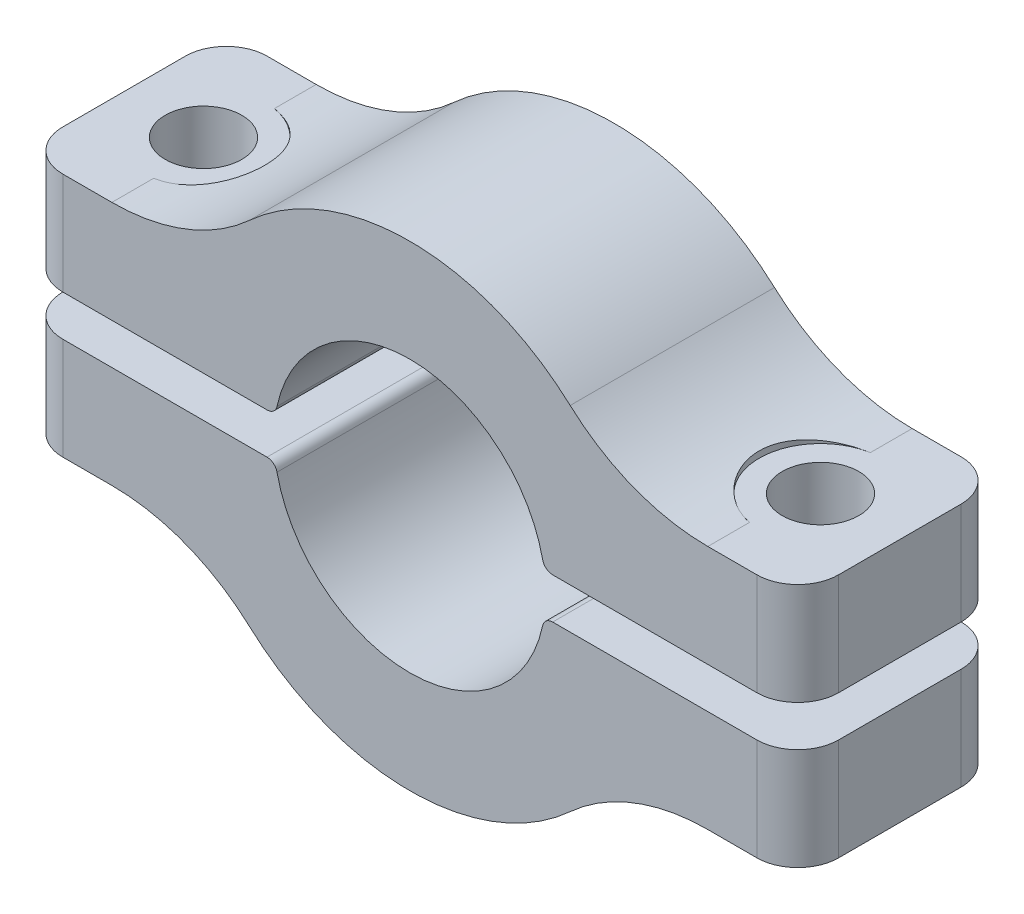
from build123d import *

# Parameters (mm, degrees)
BOSS_EXTRUDE1_DEPTH = 10
FILLET1_R           = 2
FILLET3_R           = 0.5
FILLET4_R           = 10
SKETCH2_R           = 1.875
CUT_EXTRUDE1_DEPTH  = 25.417106227
CUT_EXTRUDE2_START  = 6
SKETCH3_R           = 3
CUT_EXTRUDE2_DEPTH  = 10


with BuildPart() as part:
    # Sketch1 → Boss-Extrude1 (new body)
    with BuildSketch(Plane.XY):
        with BuildLine():
            Line((-18.986115361, 1), (-6.5743821, 1))
            ThreePointArc((-6.5743821, 1), (0, 6.65), (6.5743821, 1))
            Line((6.5743821, 1), (18.986115361, 1))
            Line((18.986115361, 1), (18.986115361, 6))
            Line((18.986115361, 6), (9.986115361, 6))
            ThreePointArc((9.986115361, 6), (0, 11.65), (-9.986115361, 6))
            Line((-9.986115361, 6), (-18.986115361, 6))
            Line((-18.986115361, 6), (-18.986115361, 1))
        make_face()
    extrude(amount=BOSS_EXTRUDE1_DEPTH)

    # Fillet1
    fillet1_edges = [part.edges().sort_by_distance(p)[0] for p in [
        (-18.986115361, 3.5, 0),
        (18.986115361, 3.5, 10),
        (-18.986115361, 3.5, 10),
        (18.986115361, 3.5, 0),
    ]]
    fillet(fillet1_edges, radius=FILLET1_R)

    # Fillet3
    fillet3_edges = [part.edges().sort_by_distance(p)[0] for p in [
        (6.5743821, 1, 5),
        (-6.5743821, 1, 5),
    ]]
    fillet(fillet3_edges, radius=FILLET3_R)

    # Fillet4
    fillet4_edges = [part.edges().sort_by_distance(p)[0] for p in [
        (-9.986115361, 6, 5),
        (9.986115361, 6, 5),
    ]]
    fillet(fillet4_edges, radius=FILLET4_R)

    # Sketch2 → Cut-Extrude1 (cut, through all)
    with BuildSketch(Plane(origin=(0, 0, 0), x_dir=(1, 0, 0), z_dir=(0, 1, 0))):
        with Locations(Location((-15.1, -5, 0), (0, 0, 74.058148942))):
            Circle(SKETCH2_R)
        with Locations(Location((15.1, -5, 0), (0, 0, 105.941851061))):
            Circle(SKETCH2_R)
    extrude(amount=CUT_EXTRUDE1_DEPTH, mode=Mode.SUBTRACT)

    # Sketch3 → Cut-Extrude2 (cut)
    with BuildSketch(Plane(origin=(0, 0, 0), x_dir=(1, 0, 0), z_dir=(0, 1, 0)).offset(CUT_EXTRUDE2_START)):
        with Locations((-15.1, -5)):
            Circle(SKETCH3_R)
        with Locations((15.1, -5)):
            Circle(SKETCH3_R)
    extrude(amount=CUT_EXTRUDE2_DEPTH, mode=Mode.SUBTRACT)


with BuildPart() as body_2:
    # Mirror3: mirrored copy
    add(part.part.mirror(Plane.ZX))


solid = Compound([part.part, body_2.part])
